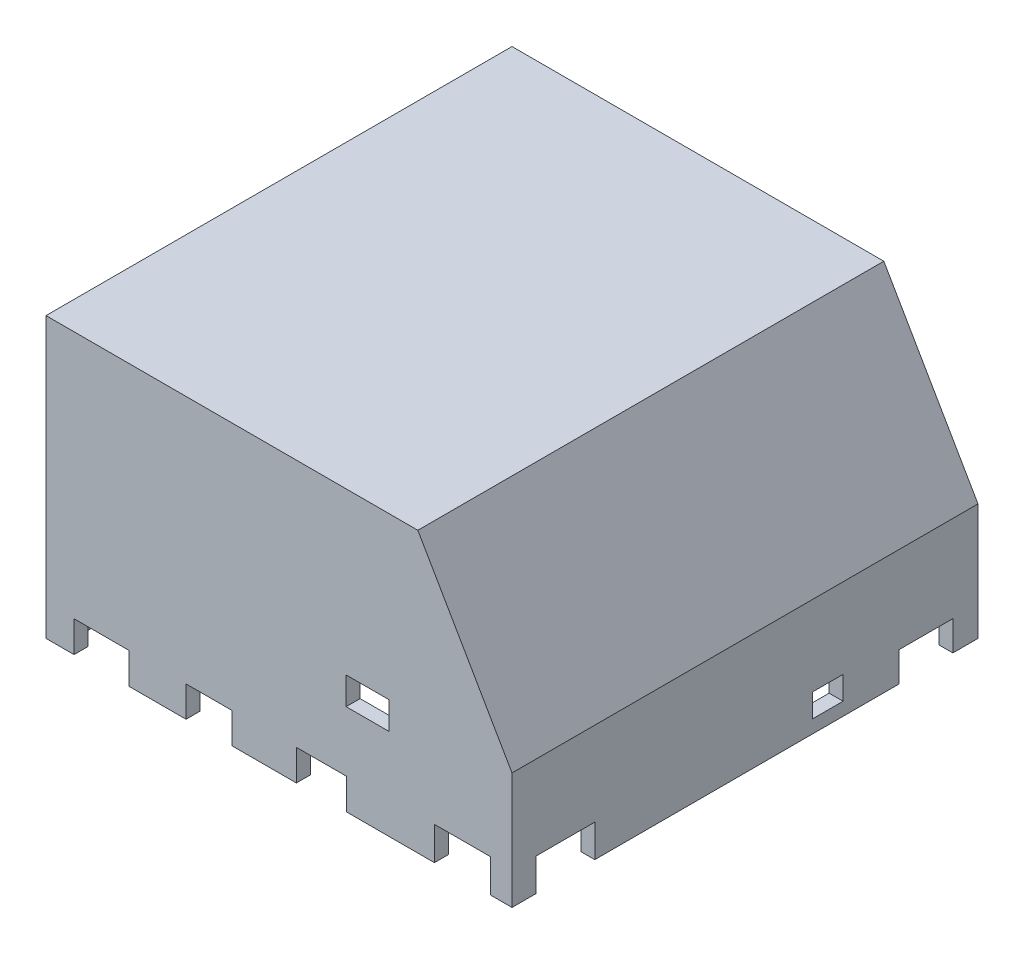
from build123d import *

# Parameters (mm, degrees)
BOSS_EXTRUDE1_DEPTH = 100
SHELL1_T            = -3
SKETCH2_W           = 56.015644735
SKETCH2_H           = 35
CUT_EXTRUDE1_DEPTH  = 10
SKETCH3_W           = 12.606592538
SKETCH3_H           = 6.980178381
SKETCH3_W_2         = 11.515112664
SKETCH3_H_2         = 6.37986445
CUT_EXTRUDE2_DEPTH  = 10
SKETCH4_W           = 9.169229256
SKETCH4_H           = 5.894504522
CUT_EXTRUDE3_DEPTH  = 10
SKETCH5_W           = 6.776014824
SKETCH5_H           = 5.054240566
CUT_EXTRUDE4_DEPTH  = 10
SKETCH6_W           = 11.990530565
SKETCH6_H           = 7.12730724
CUT_EXTRUDE5_DEPTH  = 122.475306133
SKETCH8_W           = 6.563036955
SKETCH8_H           = 5.005706152
CUT_EXTRUDE6_DEPTH  = 10
SKETCH9_W           = 11.789009043
SKETCH9_H           = 6.673883815
SKETCH9_W_2         = 10.731021053
SKETCH9_H_2         = 6.623503435
SKETCH9_W_3         = 9.824174203
SKETCH9_H_3         = 6.573123054
CUT_EXTRUDE7_DEPTH  = 122.475306133


with BuildPart() as part:
    # Sketch1 → Boss-Extrude1 (new body)
    with BuildSketch(Plane.XY):
        Polygon((-50, 12.5), (-50, 47.5), (29.792740578, 47.5), (50, 12.5), (50, -12.5), (-50, -12.5), align=None)
    extrude(amount=BOSS_EXTRUDE1_DEPTH)

    # Shell1
    shell1_openings = [part.faces().sort_by_distance(p)[0] for p in [
        (0, -12.5, 50),
    ]]
    offset(amount=SHELL1_T, openings=shell1_openings, kind=Kind.INTERSECTION)

    # Sketch2 → Cut-Extrude1 (cut)
    with BuildSketch(Plane.ZY.offset(50)):
        with Locations((51.884685058, 5)):
            Rectangle(SKETCH2_W, SKETCH2_H)
    extrude(amount=-CUT_EXTRUDE1_DEPTH, mode=Mode.SUBTRACT)

    # Sketch3 → Cut-Extrude2 (cut)
    with BuildSketch(Plane(origin=(50, 0, 0), x_dir=(0, 0, -1), z_dir=(1, 0, 0))):
        with Locations((-88.542199405, -9.009910809)):
            Rectangle(SKETCH3_W, SKETCH3_H)
        with Locations((-11.156276384, -9.310067775)):
            Rectangle(SKETCH3_W_2, SKETCH3_H_2)
    extrude(amount=-CUT_EXTRUDE2_DEPTH, mode=Mode.SUBTRACT)

    # Sketch4 → Cut-Extrude3 (cut)
    with BuildSketch(Plane.XY.offset(100)):
        with Locations((18.993403459, 9.968133111)):
            Rectangle(SKETCH4_W, SKETCH4_H)
    extrude(amount=-CUT_EXTRUDE3_DEPTH, mode=Mode.SUBTRACT)

    # Sketch5 → Cut-Extrude4 (cut)
    with BuildSketch(Plane.ZY.offset(50)):
        with Locations((8.609898129, -7.132480119)):
            Rectangle(SKETCH5_W, SKETCH5_H)
        with Locations((91.390101871, -7.132480119)):
            Rectangle(SKETCH5_W, SKETCH5_H)
    extrude(amount=-CUT_EXTRUDE4_DEPTH, mode=Mode.SUBTRACT)

    # Sketch6 → Cut-Extrude5 (cut, through all)
    with BuildSketch(Plane.XY.offset(100)):
        with Locations((39.347077193, -8.93634638)):
            Rectangle(SKETCH6_W, SKETCH6_H)
    extrude(amount=-CUT_EXTRUDE5_DEPTH, mode=Mode.SUBTRACT)

    # Sketch8 → Cut-Extrude6 (cut)
    with BuildSketch(Plane(origin=(50, 0, 0), x_dir=(0, 0, -1), z_dir=(1, 0, 0))):
        with Locations((-32.231091097, -7.194817018)):
            Rectangle(SKETCH8_W, SKETCH8_H)
    extrude(amount=-CUT_EXTRUDE6_DEPTH, mode=Mode.SUBTRACT)

    # Sketch9 → Cut-Extrude7 (cut, through all)
    with BuildSketch(Plane.XY.offset(100)):
        with Locations((-38.087567679, -9.163058093)):
            Rectangle(SKETCH9_W, SKETCH9_H)
        with Locations((9.093658686, -9.188248283)):
            Rectangle(SKETCH9_W_2, SKETCH9_H_2)
        with Locations((-15.038543588, -9.213438473)):
            Rectangle(SKETCH9_W_3, SKETCH9_H_3)
    extrude(amount=-CUT_EXTRUDE7_DEPTH, mode=Mode.SUBTRACT)


solid = part.part
